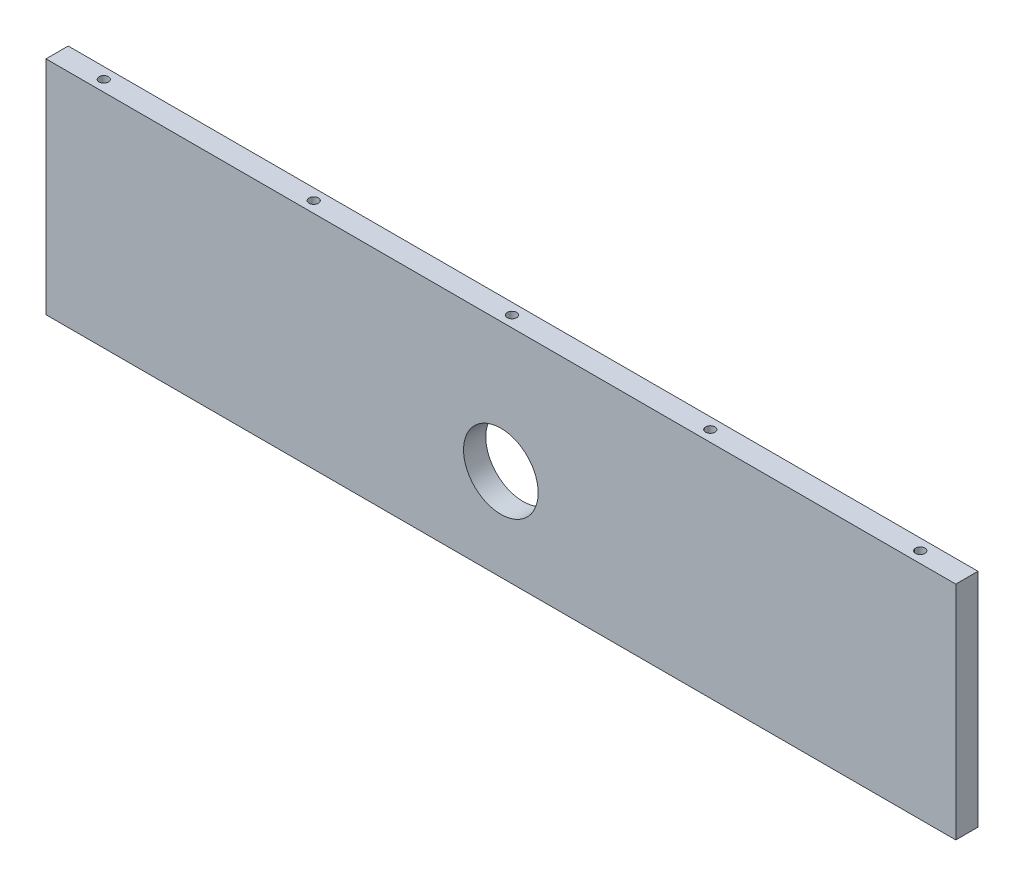
from build123d import *

# Parameters (mm, degrees)
ESBO_O1_W                  = 390
ESBO_O1_H                  = 95
RESSALTO_EXTRUS_O1_DEPTH   = 9.525
ESBO_O3_R                  = 16
CIRCULO_DE_ROLAMENTO_DEPTH = 9.525
ESBO_O4_R                  = 2
CORTE_EXTRUS_O3_DEPTH      = 20
CORTE_EXTRUS_O4_START      = -20
ESBO_O5_R                  = 2
CORTE_EXTRUS_O4_DEPTH      = 20


with BuildPart() as part:
    # Esboço1 → Ressalto-extrusão1 (new body)
    with BuildSketch(Plane.XY):
        Rectangle(ESBO_O1_W, ESBO_O1_H)
    extrude(amount=RESSALTO_EXTRUS_O1_DEPTH)

    # Esboço3 → Circulo de rolamento (cut)
    with BuildSketch(Plane.XY.offset(9.525)):
        with Locations((-0.011971039, -8.12)):
            Circle(ESBO_O3_R)
    extrude(amount=-CIRCULO_DE_ROLAMENTO_DEPTH, mode=Mode.SUBTRACT)

    # Esboço4 → Corte-extrusão3 (cut)
    with BuildSketch(Plane(origin=(0, 47.5, 0), x_dir=(1, 0, 0), z_dir=(0, 1, 0))):
        with Locations(Location((175, -4.7625, 0), (0, 0, 270))):
            Circle(ESBO_O4_R)
        with Locations(Location((85, -4.7625, 0), (0, 0, 270))):
            Circle(ESBO_O4_R)
        with Locations(Location((0, -4.7625, 0), (0, 0, 270))):
            Circle(ESBO_O4_R)
        with Locations(Location((-175, -4.7625, 0), (0, 0, 90))):
            Circle(ESBO_O4_R)
        with Locations(Location((-85, -4.7625, 0), (0, 0, 90))):
            Circle(ESBO_O4_R)
    extrude(amount=-CORTE_EXTRUS_O3_DEPTH, mode=Mode.SUBTRACT)

    # Esboço5 → Corte-extrusão4 (cut)
    with BuildSketch(Plane.XZ.offset(47.5).offset(CORTE_EXTRUS_O4_START)):
        with Locations(Location((0, 4.7625, 0), (0, 0, 90))):
            Circle(ESBO_O5_R)
        with Locations(Location((-115, 4.7625, 0), (0, 0, 270))):
            Circle(ESBO_O5_R)
        with Locations(Location((115, 4.7625, 0), (0, 0, 270))):
            Circle(ESBO_O5_R)
    extrude(amount=CORTE_EXTRUS_O4_DEPTH, mode=Mode.SUBTRACT)


solid = part.part
